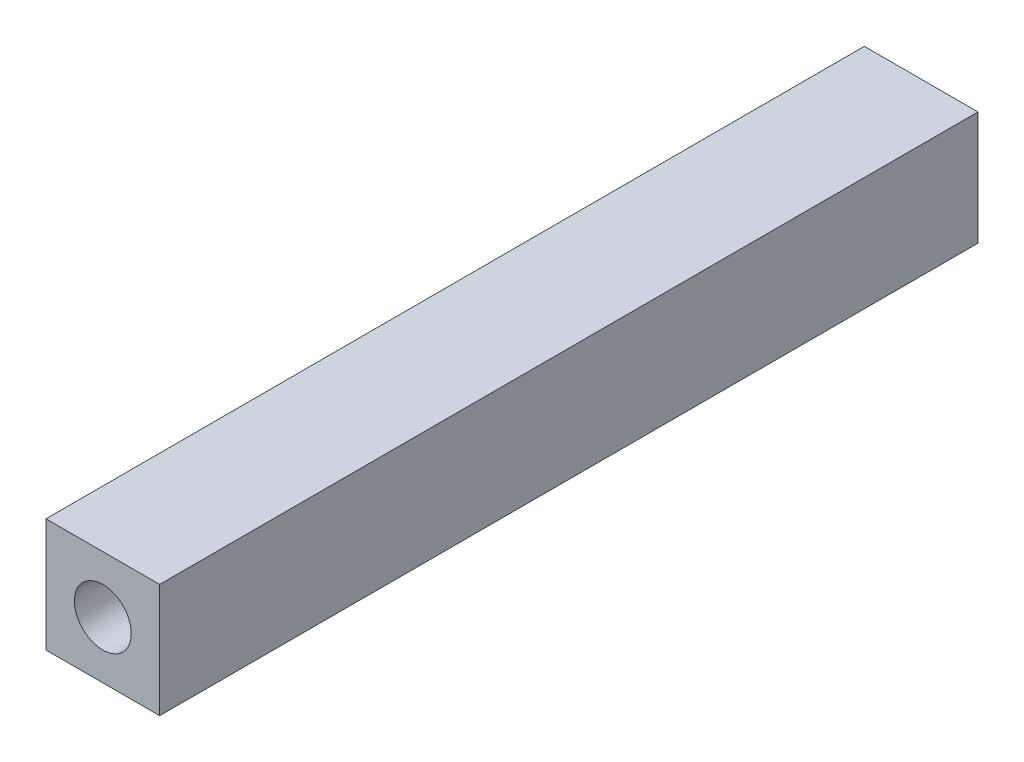
from build123d import *

# Parameters (mm, degrees)
SKETCH1_W           = 50
SKETCH1_H           = 50
SKETCH1_R           = 12.5
BOSS_EXTRUDE1_DEPTH = 360


with BuildPart() as part:
    # Sketch1 → Boss-Extrude1 (new body)
    with BuildSketch(Plane.XY):
        Rectangle(SKETCH1_W, SKETCH1_H)
        Circle(SKETCH1_R, mode=Mode.SUBTRACT)
    extrude(amount=BOSS_EXTRUDE1_DEPTH)


solid = part.part
